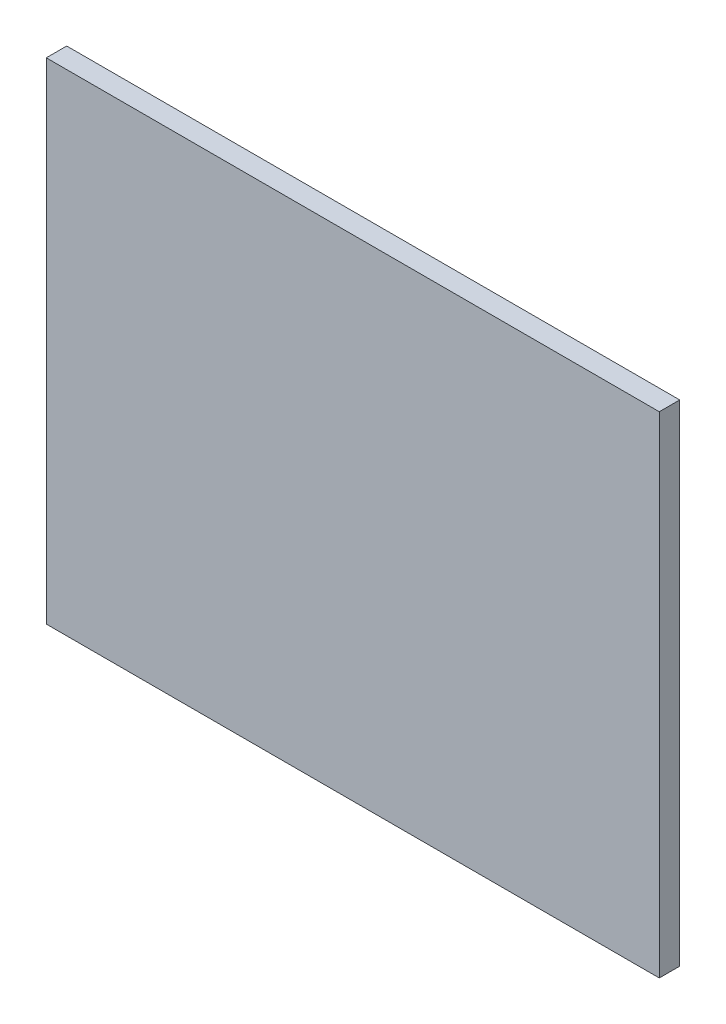
from build123d import *

# Parameters (mm, degrees)
SKETCH1_W           = 381
SKETCH1_H           = 304.8
BOSS_EXTRUDE1_DEPTH = 12.7


with BuildPart() as part:
    # Sketch1 → Boss-Extrude1 (new body)
    with BuildSketch(Plane.XY):
        with Locations((21.951655629, 19.428476821)):
            Rectangle(SKETCH1_W, SKETCH1_H)
    extrude(amount=BOSS_EXTRUDE1_DEPTH)


solid = part.part
